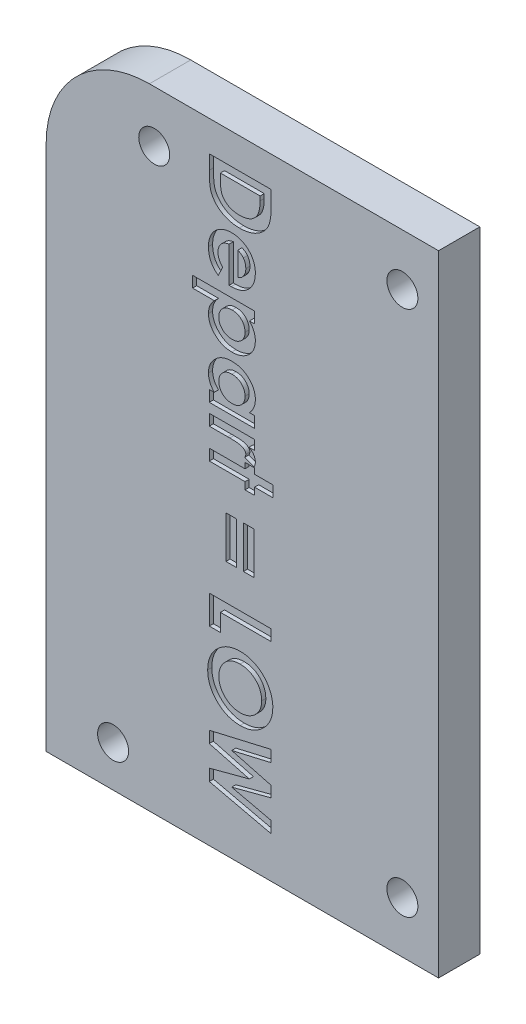
from build123d import *

# Parameters (mm, degrees)
ESQUISSE1_W             = 38
ESQUISSE1_H             = 61
BOSS_EXTRU_1_DEPTH      = 4
ESQUISSE2_R             = 1.5
ENL_V_MAT_EXTRU_1_DEPTH = 4
CONG_1_R                = 10
ESQUISSE3_W             = 1
ESQUISSE3_H             = 4.076923077
ENL_V_MAT_EXTRU_2_DEPTH = 0.4


with BuildPart() as part:
    # Esquisse1 → Boss.-Extru.1 (new body)
    with BuildSketch(Plane.XY):
        Rectangle(ESQUISSE1_W, ESQUISSE1_H)
    extrude(amount=BOSS_EXTRU_1_DEPTH)

    # Esquisse2 → Enlèv. mat.-Extru.1 (cut)
    with BuildSketch(Plane(origin=(0, 0, 0), x_dir=(-1, 0, 0), z_dir=(0, 0, -1))):
        with Locations((12.516935202, -26.5)):
            Circle(ESQUISSE2_R)
        with Locations((-15.5, -25.5)):
            Circle(ESQUISSE2_R)
        with Locations((-15.5, 25.5)):
            Circle(ESQUISSE2_R)
        with Locations((8.533870405, 25.5)):
            Circle(ESQUISSE2_R)
    extrude(amount=-ENL_V_MAT_EXTRU_1_DEPTH, mode=Mode.SUBTRACT)

    # Congé1
    cong_1_edges = [part.edges().sort_by_distance(p)[0] for p in [
        (-19, 30.5, 2),
    ]]
    fillet(cong_1_edges, radius=CONG_1_R)

    # Esquisse3 → Enlèv. mat.-Extru.2 (cut)
    # profile 1 of 11: a face of its own
    with BuildSketch(Plane.XY.offset(4)):
        with BuildLine():
            Line((2.796806549, 27.529674897), (2.796806549, 26.172703744))
            add(Edge.make_bspline(
                [(2.796806549, 26.172703744), (2.79606699, 26.066912251), (2.794637415, 25.862416099), (2.778530942, 25.566141362), (2.753757676, 25.290644531), (2.719686212, 25.035743694), (2.674571852, 24.801975856), (2.618077654, 24.589594657), (2.552445312, 24.397698949), (2.476172631, 24.224034615), (2.386674447, 24.065936146), (2.286138653, 23.916879099), (2.173043446, 23.775145164), (2.047129164, 23.639948218), (1.90923202, 23.510958965), (1.756575614, 23.39120527), (1.593113874, 23.276847929), (1.418279487, 23.169742397), (1.232417614, 23.074405098), (1.038453588, 22.989544212), (0.836261345, 22.918839767), (0.626120061, 22.861269698), (0.408638466, 22.815411956), (0.183402175, 22.783318105), (-0.049387045, 22.763479416), (-0.207159473, 22.761466797), (-0.287328066, 22.760444128)],
                knots=[0, 0, 0, 0, 1.443473934, 2.790251435, 4.047465151, 5.217279069, 6.298047006, 7.293970747, 8.213772908, 9.063072335, 9.878180301, 10.689410498, 11.514196541, 12.349783386, 13.208549609, 14.087984609, 14.994942826, 15.929749014, 16.883358292, 17.843153412, 18.816615524, 19.8034191, 20.814532747, 21.847477555, 22.906243002, 24, 24, 24, 24], degree=3))
            add(Edge.make_bspline(
                [(-0.287328066, 22.760444128), (-0.400451319, 22.763121755), (-0.623141064, 22.768392821), (-0.94993368, 22.812798134), (-1.263204743, 22.884604849), (-1.560467556, 22.985612486), (-1.839205035, 23.110693051), (-2.093833571, 23.26049247), (-2.324872243, 23.430707662), (-2.528487468, 23.622849104), (-2.704569502, 23.830562853), (-2.853612521, 24.04726499), (-2.973252606, 24.272760839), (-3.047946776, 24.471874663), (-3.094935085, 24.645012767), (-3.122086475, 24.796817126), (-3.147949477, 24.969468317), (-3.167158791, 25.164076646), (-3.184765321, 25.380389745), (-3.19421405, 25.618557276), (-3.20210564, 25.878179786), (-3.202821346, 26.058513325), (-3.203193451, 26.152271051)],
                knots=[0, 0, 0, 0, 1.315357893, 2.589359008, 3.828307697, 5.048525571, 6.235260212, 7.375784434, 8.478395391, 9.566323578, 10.624275077, 11.640246088, 12.619991216, 13.585951757, 14.107079058, 14.704817694, 15.378369799, 16.137463096, 16.978827496, 17.902494345, 18.909479843, 20, 20, 20, 20], degree=3))
            Line((-3.203193451, 26.152271051), (-3.203193451, 27.529674897))
            Line((-3.203193451, 27.529674897), (2.796806549, 27.529674897))
        make_face()
        with BuildLine():
            Line((1.719883472, 26.452751821), (-2.126270374, 26.452751821))
            Line((-2.126270374, 26.452751821), (-2.126270374, 25.890251821))
            add(Edge.make_bspline(
                [(-2.126270374, 25.890251821), (-2.126147733, 25.823322959), (-2.125911853, 25.694596478), (-2.114676675, 25.508744578), (-2.103399654, 25.336878695), (-2.081995493, 25.179471934), (-2.058152762, 25.03537874), (-2.024972339, 24.906578575), (-1.990119115, 24.790416307), (-1.945746641, 24.688310837), (-1.895802468, 24.594790545), (-1.837287079, 24.508201441), (-1.77230795, 24.424618697), (-1.698953934, 24.345605035), (-1.618196446, 24.270861118), (-1.529619109, 24.200830294), (-1.43349323, 24.13457345), (-1.329306409, 24.073808422), (-1.218175046, 24.018228603), (-1.101112872, 23.969125277), (-0.977481725, 23.927673078), (-0.847336326, 23.896194172), (-0.711484287, 23.869378292), (-0.569052119, 23.85001517), (-0.420505158, 23.839466074), (-0.319395256, 23.83807365), (-0.268097297, 23.837367205)],
                knots=[0, 0, 0, 0, 1.502785267, 2.890356349, 4.180881464, 5.369512404, 6.456827674, 7.458527365, 8.354953631, 9.177280646, 9.954299195, 10.732931168, 11.52132839, 12.330004022, 13.151395147, 13.990341431, 14.86389591, 15.771318928, 16.696852441, 17.652725226, 18.620174565, 19.621874256, 20.657747019, 21.729235313, 22.847930884, 24, 24, 24, 24], degree=3))
            add(Edge.make_bspline(
                [(-0.268097297, 23.837367205), (-0.189492434, 23.838802285), (-0.036219042, 23.84160058), (0.187027, 23.868586727), (0.397246592, 23.912515026), (0.593659552, 23.975196477), (0.776817906, 24.054208389), (0.945169913, 24.153110214), (1.101543655, 24.2676456), (1.193277509, 24.358217058), (1.239114241, 24.403472974)],
                knots=[0, 0, 0, 0, 1.13821349, 2.219428113, 3.251817212, 4.244760574, 5.201143372, 6.134805572, 7.068016741, 8, 8, 8, 8], degree=3))
            add(Edge.make_bspline(
                [(1.239114241, 24.403472974), (1.278173333, 24.448099593), (1.357947106, 24.539244408), (1.453536487, 24.699264752), (1.537521127, 24.875598883), (1.60411158, 25.072280798), (1.65677415, 25.287409654), (1.693094236, 25.522266761), (1.716433139, 25.77559441), (1.718708721, 25.951093903), (1.719883472, 26.041694128)],
                knots=[0, 0, 0, 0, 0.813307809, 1.661089106, 2.549956539, 3.493439533, 4.508053171, 5.589449661, 6.755572447, 8, 8, 8, 8], degree=3))
            Line((1.719883472, 26.041694128), (1.719883472, 26.452751821))
        make_face(mode=Mode.SUBTRACT)
    # profile 2 of 11: a face of its own
    with BuildSketch(Plane.XY.offset(4)):
        with BuildLine():
            Line((-1.280116528, 17.45635759), (-1.280116528, 20.914290282))
            add(Edge.make_bspline(
                [(-1.280116528, 20.914290282), (-1.320295744, 20.907239837), (-1.399251074, 20.893385155), (-1.513940541, 20.863299221), (-1.62202196, 20.824905057), (-1.723639807, 20.778892069), (-1.819331298, 20.726036037), (-1.908647601, 20.664383854), (-1.991509826, 20.594717522), (-2.067557845, 20.517439834), (-2.135698519, 20.433838868), (-2.195394057, 20.344320058), (-2.244340746, 20.248791027), (-2.285597726, 20.148346978), (-2.318277433, 20.042237363), (-2.340816006, 19.930306016), (-2.354129624, 19.812849651), (-2.356055286, 19.732834786), (-2.357039605, 19.691934513)],
                knots=[0, 0, 0, 0, 1.091296461, 2.144483647, 3.168565212, 4.157007626, 5.126487748, 6.090021542, 7.05641414, 8.019231907, 8.98705074, 9.938580405, 10.892824166, 11.854447369, 12.841318655, 13.858982407, 14.905600794, 16, 16, 16, 16], degree=3))
            add(Edge.make_bspline(
                [(-2.357039605, 19.691934513), (-2.355736205, 19.642565107), (-2.353169426, 19.545342207), (-2.330405914, 19.402909935), (-2.296022628, 19.26515718), (-2.244891797, 19.133387569), (-2.181242899, 19.006074758), (-2.101944205, 18.885314705), (-2.009313081, 18.769017151), (-1.937913046, 18.698061938), (-1.901510759, 18.661886436)],
                knots=[0, 0, 0, 0, 1.021034703, 2.010718019, 2.977989445, 3.954245119, 4.929443971, 5.918328161, 6.938689359, 8, 8, 8, 8], degree=3))
            Line((-1.901510759, 18.661886436), (-2.330597297, 17.760444128))
            add(Edge.make_bspline(
                [(-2.330597297, 17.760444128), (-2.369784213, 17.78927328), (-2.447241979, 17.846257649), (-2.556510512, 17.938061554), (-2.659260619, 18.032697673), (-2.753322711, 18.132660306), (-2.83841034, 18.23769998), (-2.916969318, 18.34559936), (-2.986896196, 18.458248997), (-3.049756849, 18.574777248), (-3.104055068, 18.697050893), (-3.150285907, 18.824665236), (-3.192099133, 18.957016263), (-3.223953422, 19.095792829), (-3.249170478, 19.239834497), (-3.267077551, 19.389487197), (-3.278137987, 19.544730827), (-3.279449181, 19.650249033), (-3.280116528, 19.703953744)],
                knots=[0, 0, 0, 0, 1.033338888, 2.04252164, 3.030262006, 3.999752838, 4.955583682, 5.900551376, 6.833481756, 7.770287093, 8.71145193, 9.672837889, 10.652846169, 11.658324827, 12.695268294, 13.758430956, 14.85912751, 16, 16, 16, 16], degree=3))
            add(Edge.make_bspline(
                [(-3.280116528, 19.703953744), (-3.278432077, 19.786577557), (-3.275133176, 19.948391535), (-3.244514663, 20.185073734), (-3.193745858, 20.409856154), (-3.124733501, 20.623373607), (-3.033615435, 20.824702754), (-2.922170973, 21.01394461), (-2.792534502, 21.192984804), (-2.641993752, 21.356372023), (-2.478113844, 21.505166419), (-2.302210306, 21.636062575), (-2.114943689, 21.744936092), (-1.919360222, 21.837013769), (-1.711820951, 21.904515448), (-1.495275904, 21.955466402), (-1.268173581, 21.986149412), (-1.113543476, 21.9895065), (-1.03492422, 21.991213359)],
                knots=[0, 0, 0, 0, 1.103528868, 2.161197684, 3.181904866, 4.17893931, 5.15400521, 6.128071465, 7.108807125, 8.101535823, 9.090664498, 10.062772592, 11.024896103, 11.980490186, 12.945349712, 13.934753549, 14.949957771, 16, 16, 16, 16], degree=3))
            add(Edge.make_bspline(
                [(-1.03492422, 21.991213359), (-0.95430224, 21.98950273), (-0.795682115, 21.986137143), (-0.563405704, 21.955586402), (-0.341759951, 21.904873066), (-0.130545556, 21.834733061), (0.071471221, 21.746588775), (0.260877789, 21.634139607), (0.440643048, 21.504157141), (0.608301714, 21.355738059), (0.759693481, 21.191695359), (0.894661244, 21.017375923), (1.006695503, 20.831030503), (1.09818034, 20.635051496), (1.171631947, 20.429743378), (1.220804381, 20.212992549), (1.253761264, 19.986617689), (1.256800365, 19.831879435), (1.25834501, 19.75323259)],
                knots=[0, 0, 0, 0, 1.079354094, 2.123580709, 3.131027717, 4.120248802, 5.100347326, 6.076737579, 7.064152558, 8.067633759, 9.069995403, 10.049814825, 11.015114092, 11.975254693, 12.94256508, 13.929104949, 14.947452504, 16, 16, 16, 16], degree=3))
            add(Edge.make_bspline(
                [(1.25834501, 19.75323259), (1.25663569, 19.670212383), (1.253279614, 19.507210762), (1.222891871, 19.268888182), (1.171877699, 19.04258431), (1.103119814, 18.827156668), (1.010326199, 18.625126522), (0.90124942, 18.432966413), (0.768860244, 18.255041344), (0.619054387, 18.089229984), (0.452783521, 17.939687951), (0.272635509, 17.808561673), (0.078774962, 17.698923767), (-0.12730348, 17.608366516), (-0.34661749, 17.53872992), (-0.578307819, 17.48831166), (-0.823364496, 17.457697583), (-0.991164566, 17.454425458), (-1.076991528, 17.452751821)],
                knots=[0, 0, 0, 0, 1.079855552, 2.120185087, 3.119263157, 4.095157605, 5.056350796, 6.006812003, 6.964961307, 7.935564877, 8.91003822, 9.869321262, 10.82883089, 11.80218819, 12.792963453, 13.817487929, 14.883681165, 16, 16, 16, 16], degree=3))
            Line((-1.076991528, 17.452751821), (-1.280116528, 17.45635759))
        make_face()
        with BuildLine():
            add(Edge.make_bspline(
                [(-0.433962682, 18.529674897), (-0.379044422, 18.549881531), (-0.269655534, 18.590130096), (-0.120426303, 18.683147368), (0.011124009, 18.802650145), (0.125925444, 18.94376643), (0.219655164, 19.10459348), (0.287414368, 19.28059155), (0.328068325, 19.469333005), (0.332834355, 19.599184595), (0.335268087, 19.665492205)],
                knots=[0, 0, 0, 0, 0.954352776, 1.900926752, 2.851296618, 3.847186113, 4.86225778, 5.87988081, 6.91737917, 8, 8, 8, 8], degree=3))
            add(Edge.make_bspline(
                [(0.335268087, 19.665492205), (0.332929669, 19.737910197), (0.328358547, 19.879472291), (0.279742994, 20.083665974), (0.207185732, 20.276276766), (0.132377654, 20.389829172), (0.094883472, 20.446742205)],
                knots=[0, 0, 0, 0, 1.044195649, 2.041185066, 3.018232172, 4, 4, 4, 4], degree=3))
            add(Edge.make_bspline(
                [(0.094883472, 20.446742205), (0.066327082, 20.482251687), (0.005446317, 20.557956088), (-0.116005028, 20.656273611), (-0.263055343, 20.753117189), (-0.374750446, 20.808178103), (-0.433962682, 20.837367205)],
                knots=[0, 0, 0, 0, 0.82159062, 1.751589201, 2.808063854, 4, 4, 4, 4], degree=3))
            Line((-0.433962682, 20.837367205), (-0.433962682, 18.529674897))
        make_face(mode=Mode.SUBTRACT)
    # profile 3 of 11: a face of its own
    with BuildSketch(Plane.XY.offset(4)):
        with BuildLine():
            Line((1.181421934, 15.452751821), (0.687431549, 15.452751821))
            add(Edge.make_bspline(
                [(0.687431549, 15.452751821), (0.733368744, 15.402755353), (0.823584653, 15.304567451), (0.939070638, 15.143801369), (1.038321962, 14.978612701), (1.117752888, 14.806204574), (1.181400431, 14.628655243), (1.224749864, 14.44433548), (1.254418525, 14.254191295), (1.257024106, 14.125143813), (1.25834501, 14.059722974)],
                knots=[0, 0, 0, 0, 1.054345398, 2.070625563, 3.070134531, 4.045138923, 5.016019057, 5.996139535, 6.984139557, 8, 8, 8, 8], degree=3))
            add(Edge.make_bspline(
                [(1.25834501, 14.059722974), (1.256653401, 13.989099533), (1.25332148, 13.84999427), (1.222213202, 13.645327348), (1.17192882, 13.449191039), (1.101718089, 13.260837513), (1.010561289, 13.081269972), (0.901417825, 12.90847208), (0.769785758, 12.745419212), (0.620684314, 12.592050524), (0.457280897, 12.450125898), (0.279542005, 12.326878543), (0.090337291, 12.223551637), (-0.109797141, 12.138708029), (-0.321200333, 12.072751439), (-0.543905771, 12.024380592), (-0.778222776, 11.996887811), (-0.93789879, 11.993129361), (-1.01929922, 11.991213359)],
                knots=[0, 0, 0, 0, 0.986020426, 1.942140297, 2.884184618, 3.810402461, 4.74398011, 5.692601402, 6.660167734, 7.665472218, 8.677406811, 9.678762208, 10.680617953, 11.68372348, 12.710362081, 13.769660087, 14.863006259, 16, 16, 16, 16], degree=3))
            add(Edge.make_bspline(
                [(-1.01929922, 11.991213359), (-1.097909875, 11.993036678), (-1.252868809, 11.996630842), (-1.480344561, 12.02573917), (-1.69771221, 12.074899393), (-1.90459815, 12.144412694), (-2.102917909, 12.230602603), (-2.291296898, 12.337948825), (-2.468077341, 12.46674105), (-2.634585408, 12.610782976), (-2.784366131, 12.769951047), (-2.917454529, 12.936479497), (-3.029125386, 13.111484343), (-3.120946153, 13.293337261), (-3.192487561, 13.483126509), (-3.242209799, 13.679937408), (-3.27553319, 13.883511719), (-3.278573532, 14.021927754), (-3.280116528, 14.092174897)],
                knots=[0, 0, 0, 0, 1.098417511, 2.1652231, 3.198950626, 4.208261081, 5.211182938, 6.216867778, 7.231677337, 8.263598561, 9.289470716, 10.282037912, 11.238882362, 12.185464344, 13.124613954, 14.067146156, 15.019062619, 16, 16, 16, 16], degree=3))
            add(Edge.make_bspline(
                [(-3.280116528, 14.092174897), (-3.278598413, 14.154772452), (-3.275607819, 14.278085868), (-3.24894287, 14.459415375), (-3.209114501, 14.634581739), (-3.149168365, 14.803816668), (-3.069620347, 14.969022666), (-2.970557673, 15.133013396), (-2.849535754, 15.296168067), (-2.756191566, 15.399437389), (-2.708001143, 15.452751821)],
                knots=[0, 0, 0, 0, 0.990856396, 1.951927477, 2.896945079, 3.83213376, 4.788585491, 5.796263726, 6.862286081, 8, 8, 8, 8], degree=3))
            Line((-2.708001143, 15.452751821), (-4.818578066, 15.452751821))
            Line((-4.818578066, 15.452751821), (-4.818578066, 16.529674897))
            Line((-4.818578066, 16.529674897), (1.181421934, 16.529674897))
            Line((1.181421934, 16.529674897), (1.181421934, 15.452751821))
        make_face()
        with BuildLine():
            add(Edge.make_bspline(
                [(0.25834501, 14.292896051), (0.257001098, 14.33660084), (0.2543663, 14.422285986), (0.239265295, 14.548086743), (0.210855666, 14.667287614), (0.174024097, 14.781689527), (0.124343677, 14.889885587), (0.063988831, 14.992605139), (-0.007306265, 15.08931372), (-0.089293814, 15.178770476), (-0.178123929, 15.262094095), (-0.276785629, 15.332624703), (-0.379866377, 15.394772362), (-0.490907926, 15.444484377), (-0.608686945, 15.482473303), (-0.732931992, 15.510500089), (-0.86387204, 15.525764399), (-0.95315667, 15.528350782), (-0.998866528, 15.529674897)],
                knots=[0, 0, 0, 0, 1.060568847, 2.079291485, 3.067175794, 4.029236509, 4.990511307, 5.949030319, 6.915206611, 7.899210179, 8.889768581, 9.863784456, 10.835615511, 11.805743859, 12.80777611, 13.833568643, 14.890881125, 16, 16, 16, 16], degree=3))
            add(Edge.make_bspline(
                [(-0.998866528, 15.529674897), (-1.045376334, 15.528334123), (-1.136653832, 15.525702795), (-1.270386119, 15.510565356), (-1.397119737, 15.482736216), (-1.516991319, 15.443948712), (-1.630744814, 15.395106577), (-1.736390067, 15.333002327), (-1.836424917, 15.261703084), (-1.927649974, 15.179241401), (-2.010715482, 15.089247913), (-2.083415049, 14.992966858), (-2.143858524, 14.889910616), (-2.192725925, 14.781197502), (-2.233363516, 14.667808555), (-2.2608155, 14.548011866), (-2.276196542, 14.422305854), (-2.278792452, 14.336607551), (-2.280116528, 14.292896051)],
                knots=[0, 0, 0, 0, 1.117303121, 2.19275548, 3.227126012, 4.228333087, 5.215193878, 6.193951608, 7.166063962, 8.161008357, 9.141703709, 10.104002538, 11.052977519, 12.004680845, 12.963364262, 13.941412147, 14.949991302, 16, 16, 16, 16], degree=3))
            add(Edge.make_bspline(
                [(-2.280116528, 14.292896051), (-2.278901855, 14.250770044), (-2.276497498, 14.167384713), (-2.259231833, 14.045069765), (-2.232223892, 13.927562787), (-2.191443976, 13.816014909), (-2.141402108, 13.709027659), (-2.079484914, 13.606961162), (-2.005483192, 13.510922765), (-1.922139301, 13.419600661), (-1.828805021, 13.337949194), (-1.730000891, 13.264361662), (-1.623388875, 13.204452811), (-1.510854005, 13.15523524), (-1.392915642, 13.114933666), (-1.267982407, 13.087310214), (-1.137064299, 13.072138131), (-1.047782019, 13.069483586), (-1.002472297, 13.068136436)],
                knots=[0, 0, 0, 0, 1.021479428, 2.021943319, 2.990662685, 3.940432525, 4.896741647, 5.851667391, 6.829265152, 7.833309205, 8.845269013, 9.832622089, 10.816142259, 11.803782204, 12.808625337, 13.834164129, 14.900863427, 16, 16, 16, 16], degree=3))
            add(Edge.make_bspline(
                [(-1.002472297, 13.068136436), (-0.957569867, 13.069504484), (-0.869099507, 13.072199921), (-0.739276504, 13.087069784), (-0.616141971, 13.115724342), (-0.498689986, 13.151904371), (-0.388449471, 13.202451113), (-0.284116297, 13.262217539), (-0.185375437, 13.332543812), (-0.094892412, 13.41412532), (-0.01255936, 13.503605854), (0.060264904, 13.599124801), (0.122259102, 13.700307048), (0.171148549, 13.808530476), (0.211374028, 13.921241183), (0.239081869, 14.040161624), (0.254416939, 14.164687218), (0.257018067, 14.249585788), (0.25834501, 14.292896051)],
                knots=[0, 0, 0, 0, 1.094680664, 2.156827393, 3.177782763, 4.17210342, 5.146667393, 6.126451192, 7.099203661, 8.094961544, 9.09004898, 10.058676268, 11.018205477, 11.974998356, 12.947750825, 13.930643515, 14.944335875, 16, 16, 16, 16], degree=3))
        make_face(mode=Mode.SUBTRACT)
    # profile 4 of 11: a face of its own
    with BuildSketch(Plane.XY.offset(4)):
        with BuildLine():
            Line((1.181421934, 7.760444128), (1.181421934, 6.683521051))
            Line((1.181421934, 6.683521051), (-3.203193451, 6.683521051))
            Line((-3.203193451, 6.683521051), (-3.203193451, 7.760444128))
            Line((-3.203193451, 7.760444128), (-2.724828066, 7.760444128))
            add(Edge.make_bspline(
                [(-2.724828066, 7.760444128), (-2.77138617, 7.81380768), (-2.861746255, 7.917375796), (-2.979079325, 8.080525328), (-3.075355333, 8.243986807), (-3.153353852, 8.408498004), (-3.209379433, 8.577554885), (-3.250897086, 8.751567386), (-3.275117471, 8.932839896), (-3.278432818, 9.056046387), (-3.280116528, 9.118617205)],
                knots=[0, 0, 0, 0, 1.129160586, 2.191477711, 3.199794721, 4.151823543, 5.089502826, 6.035032201, 7.00208469, 8, 8, 8, 8], degree=3))
            add(Edge.make_bspline(
                [(-3.280116528, 9.118617205), (-3.278536242, 9.188857579), (-3.275413509, 9.32765654), (-3.242545049, 9.531329928), (-3.192225353, 9.727991684), (-3.121042923, 9.917506713), (-3.028707807, 10.099437831), (-2.918233703, 10.275264114), (-2.783934312, 10.440925969), (-2.634260141, 10.600011502), (-2.468468184, 10.745294075), (-2.291291655, 10.874087107), (-2.10262512, 10.981114545), (-1.904909982, 11.069092679), (-1.697668704, 11.138197163), (-1.480356687, 11.187484481), (-1.252865632, 11.216557848), (-1.097908806, 11.220156828), (-1.01929922, 11.22198259)],
                knots=[0, 0, 0, 0, 0.980545136, 1.937612761, 2.874348888, 3.813122963, 4.759326438, 5.720509799, 6.70829705, 7.733758992, 8.768951258, 9.783355028, 10.788637727, 11.793421666, 12.80232853, 13.835642703, 14.90202171, 16, 16, 16, 16], degree=3))
            add(Edge.make_bspline(
                [(-1.01929922, 11.22198259), (-0.937898439, 11.220067226), (-0.778221735, 11.216310025), (-0.543909698, 11.188808236), (-0.321186283, 11.140469982), (-0.109847364, 11.074396867), (0.090698555, 10.989900458), (0.279194146, 10.88488371), (0.457331759, 10.761960714), (0.620671573, 10.619919032), (0.769785863, 10.466579989), (0.901428976, 10.303524484), (1.010517753, 10.130709312), (1.102048675, 9.950876723), (1.171437176, 9.762245939), (1.222581775, 9.565951246), (1.253193861, 9.361171761), (1.256613701, 9.221684961), (1.25834501, 9.151069128)],
                knots=[0, 0, 0, 0, 1.136421085, 2.229216585, 3.287981067, 4.314102594, 5.316702899, 6.320753391, 7.321604446, 8.333029371, 9.337827526, 10.304906535, 11.253050047, 12.186157492, 13.117149921, 14.053303955, 15.014476191, 16, 16, 16, 16], degree=3))
            add(Edge.make_bspline(
                [(1.25834501, 9.151069128), (1.256986021, 9.08565515), (1.254297072, 8.956224465), (1.225100226, 8.765980007), (1.180942069, 8.581470321), (1.118024644, 8.403701918), (1.038578595, 8.231216681), (0.939026774, 8.066981466), (0.8235533, 7.907403479), (0.73336607, 7.810035816), (0.687431549, 7.760444128)],
                knots=[0, 0, 0, 0, 1.017011718, 2.012299608, 2.98747302, 3.965332399, 4.941441765, 5.936729654, 6.94912688, 8, 8, 8, 8], degree=3))
            Line((0.687431549, 7.760444128), (1.181421934, 7.760444128))
        make_face()
        with BuildLine():
            add(Edge.make_bspline(
                [(0.25834501, 8.92510759), (0.257028316, 8.9680198), (0.25444768, 9.05212493), (0.238924976, 9.175813033), (0.211573281, 9.294021755), (0.171167024, 9.40590804), (0.121946316, 9.513139405), (0.060298189, 9.614087525), (-0.012568587, 9.709585555), (-0.094889908, 9.799071861), (-0.185376091, 9.880651815), (-0.284116122, 9.950978496), (-0.388449518, 10.010744813), (-0.498689974, 10.061291585), (-0.616141974, 10.097471605), (-0.739276503, 10.126126166), (-0.869099508, 10.140996028), (-0.957569867, 10.143691465), (-1.002472297, 10.145059513)],
                knots=[0, 0, 0, 0, 1.04836806, 2.054732945, 3.03993516, 4.00574415, 4.955904794, 5.917688631, 6.888591924, 7.88601754, 8.884115178, 9.859153345, 10.841239365, 11.818093293, 12.814750328, 13.83810466, 14.90274714, 16, 16, 16, 16], degree=3))
            add(Edge.make_bspline(
                [(-1.002472297, 10.145059513), (-1.047782366, 10.143712969), (-1.13706533, 10.141059619), (-1.267978489, 10.125878887), (-1.392929597, 10.098286671), (-1.510803376, 10.057872226), (-1.623757324, 10.008987441), (-1.729651928, 9.947417875), (-1.828838351, 9.874123366), (-1.922201853, 9.792423599), (-2.004992023, 9.701111686), (-2.080318447, 9.605992015), (-2.140607302, 9.503332881), (-2.19212895, 9.396678463), (-2.231700139, 9.285057811), (-2.259462347, 9.167791447), (-2.276451648, 9.04579772), (-2.278886466, 8.962421369), (-2.280116528, 8.920299897)],
                knots=[0, 0, 0, 0, 1.099386164, 2.166327687, 3.192099357, 4.19717067, 5.185034887, 6.173616074, 7.161193358, 8.17338296, 9.177655011, 10.147763629, 11.111227589, 12.058972978, 13.018112925, 13.97759754, 14.978288615, 16, 16, 16, 16], degree=3))
            add(Edge.make_bspline(
                [(-2.280116528, 8.920299897), (-2.278792413, 8.876588435), (-2.276196429, 8.790890207), (-2.260815927, 8.66518366), (-2.233361978, 8.545388914), (-2.192731532, 8.431992908), (-2.143837775, 8.323305826), (-2.08349272, 8.220152377), (-2.010239171, 8.124005621), (-1.928561595, 8.032595217), (-1.835496722, 7.951857258), (-1.737224044, 7.87853355), (-1.630298123, 7.818435366), (-1.517063255, 7.769131055), (-1.397099662, 7.730492154), (-1.27039178, 7.70262145), (-1.136652328, 7.687495582), (-1.045375827, 7.684862646), (-0.998866528, 7.683521051)],
                knots=[0, 0, 0, 0, 1.049905731, 2.058385982, 3.036337956, 3.994927362, 4.946537361, 5.895419282, 6.857623746, 7.845325573, 8.833777008, 9.811444928, 10.78531754, 11.772081556, 12.77319045, 13.807459548, 14.882806445, 16, 16, 16, 16], degree=3))
            add(Edge.make_bspline(
                [(-0.998866528, 7.683521051), (-0.953157181, 7.684845974), (-0.863873547, 7.687433934), (-0.732926361, 7.702686952), (-0.608707189, 7.730754677), (-0.490835201, 7.768596503), (-0.380313683, 7.818754509), (-0.275944792, 7.878923269), (-0.17905943, 7.951451361), (-0.088367504, 8.033075934), (-0.007834529, 8.123962544), (0.06446332, 8.220683906), (0.123951603, 8.324343814), (0.174337743, 8.432985164), (0.210809698, 8.548351942), (0.239149971, 8.668336191), (0.254436823, 8.794911266), (0.257021022, 8.881000596), (0.25834501, 8.92510759)],
                knots=[0, 0, 0, 0, 1.106469885, 2.16125711, 3.184599668, 4.184238692, 5.152050012, 6.116650044, 7.094080022, 8.075733422, 9.064591803, 10.028460505, 10.993060537, 11.952039452, 12.921015874, 13.915988178, 14.932277727, 16, 16, 16, 16], degree=3))
        make_face(mode=Mode.SUBTRACT)
    # profile 5 of 11: a face of its own
    with BuildSketch(Plane.XY.offset(4)):
        with BuildLine():
            Line((1.181421934, 5.760444128), (1.181421934, 4.837367205))
            Line((1.181421934, 4.837367205), (0.641758472, 4.837367205))
            add(Edge.make_bspline(
                [(0.641758472, 4.837367205), (0.68972345, 4.811258866), (0.78347299, 4.760229034), (0.909231465, 4.666417531), (1.015672353, 4.558658894), (1.103243682, 4.439879), (1.172170287, 4.311829408), (1.221702392, 4.177131668), (1.253323228, 4.036343461), (1.25665903, 3.940098079), (1.25834501, 3.891453744)],
                knots=[0, 0, 0, 0, 1.098811016, 2.147671717, 3.146071787, 4.13848817, 5.109520547, 6.064226209, 7.021621331, 8, 8, 8, 8], degree=3))
            add(Edge.make_bspline(
                [(1.25834501, 3.891453744), (1.256690887, 3.856129021), (1.253322501, 3.784195272), (1.233742022, 3.674558116), (1.198336793, 3.563339088), (1.166459089, 3.490147384), (1.150171934, 3.452751821)],
                knots=[0, 0, 0, 0, 0.931404136, 1.896671404, 2.925354185, 4, 4, 4, 4], degree=3))
            Line((1.150171934, 3.452751821), (0.237912318, 3.786886436))
            add(Edge.make_bspline(
                [(0.237912318, 3.786886436), (0.252342542, 3.816753299), (0.279465809, 3.872891505), (0.311474058, 3.954394431), (0.331003927, 4.028361717), (0.333917955, 4.075255618), (0.335268087, 4.09698259)],
                knots=[0, 0, 0, 0, 1.214386998, 2.282580073, 3.20428172, 4, 4, 4, 4], degree=3))
            add(Edge.make_bspline(
                [(0.335268087, 4.09698259), (0.334373418, 4.117497076), (0.332613449, 4.157852606), (0.317531115, 4.21741624), (0.291522096, 4.273512774), (0.258201965, 4.328845527), (0.211884475, 4.37904924), (0.158263819, 4.429222339), (0.092061721, 4.473435933), (0.018376527, 4.52010125), (-0.071819075, 4.559804498), (-0.179471017, 4.593991182), (-0.306012508, 4.623803604), (-0.4514405, 4.647191347), (-0.615572241, 4.664677596), (-0.798382695, 4.677538101), (-0.999985067, 4.686236283), (-1.140683513, 4.686821714), (-1.214010759, 4.687126821)],
                knots=[0, 0, 0, 0, 0.544215582, 1.070565812, 1.618201885, 2.182027731, 2.777483228, 3.425105563, 4.127550611, 4.886526539, 5.73878038, 6.7345772, 7.882815618, 9.187506016, 10.643077814, 12.264316551, 14.053088836, 16, 16, 16, 16], degree=3))
            Line((-1.214010759, 4.687126821), (-1.427953066, 4.683521051))
            Line((-1.427953066, 4.683521051), (-3.203193451, 4.683521051))
            Line((-3.203193451, 4.683521051), (-3.203193451, 5.760444128))
            Line((-3.203193451, 5.760444128), (1.181421934, 5.760444128))
        make_face()
    # profile 6 of 11: a face of its own
    with BuildSketch(Plane.XY.offset(4)):
        Polygon((2.950652703, 2.837367205), (2.950652703, 1.760444128), (1.181421934, 1.760444128), (1.181421934, 1.068136436), (0.25834501, 1.068136436), (0.25834501, 1.760444128), (-3.203193451, 1.760444128), (-3.203193451, 2.837367205), (0.25834501, 2.837367205), (0.25834501, 3.375828744), (1.181421934, 3.375828744), (1.181421934, 2.837367205), align=None)
    # profile 7 of 11: a face of its own
    with BuildSketch(Plane.XY.offset(4)):
        with Locations((0.604498857, -3.816478949)):
            Rectangle(ESQUISSE3_W, ESQUISSE3_H)
    # profile 8 of 11: a face of its own
    with BuildSketch(Plane.XY.offset(4)):
        with Locations((-1.087808836, -3.816478949)):
            Rectangle(ESQUISSE3_W, ESQUISSE3_H)
    # profile 9 of 11: a face of its own
    with BuildSketch(Plane.XY.offset(4)):
        Polygon((2.796806549, -9.316478949), (2.796806549, -10.393402026), (-2.126270374, -10.393402026), (-2.126270374, -12.085709718), (-3.203193451, -12.085709718), (-3.203193451, -9.316478949), align=None)
    # profile 10 of 11: a face of its own
    with BuildSketch(Plane.XY.offset(4)):
        with BuildLine():
            add(Edge.make_bspline(
                [(2.950652703, -15.828498179), (2.947953351, -15.932816378), (2.942624218, -16.13876413), (2.898152005, -16.441624312), (2.825814697, -16.733542948), (2.724700181, -17.014458179), (2.594180606, -17.283988452), (2.433718598, -17.541442807), (2.24581213, -17.78848331), (2.030806355, -18.020549216), (1.795857339, -18.233416097), (1.545358947, -18.42057538), (1.282106101, -18.579017365), (1.006332224, -18.708587341), (0.717462994, -18.808919116), (0.415649244, -18.87895321), (0.101448046, -18.924052223), (-0.112491751, -18.929231369), (-0.221222297, -18.931863564)],
                knots=[0, 0, 0, 0, 1.014244935, 2.002349224, 2.970143685, 3.935298574, 4.900830986, 5.877310296, 6.881148894, 7.915268703, 8.949887647, 9.960720774, 10.951801935, 11.933244874, 12.919141415, 13.920101769, 14.942934067, 16, 16, 16, 16], degree=3))
            add(Edge.make_bspline(
                [(-0.221222297, -18.931863564), (-0.328727822, -18.929060407), (-0.540570907, -18.923536697), (-0.851874886, -18.880791172), (-1.150461928, -18.809584283), (-1.436503151, -18.710915376), (-1.710060644, -18.583839917), (-1.970848718, -18.428194724), (-2.21787324, -18.24255937), (-2.450528077, -18.033050265), (-2.66164738, -17.802394084), (-2.848202776, -17.558000728), (-3.0051505, -17.300356209), (-3.134775291, -17.031281425), (-3.234988514, -16.749599886), (-3.305763571, -16.455951032), (-3.348758549, -16.150285116), (-3.354251492, -15.942419999), (-3.357039605, -15.836911641)],
                knots=[0, 0, 0, 0, 1.051446269, 2.071908608, 3.067230498, 4.050151293, 5.026863609, 6.012936299, 7.01551645, 8.045060801, 9.071444569, 10.070117656, 11.048150216, 12.017576978, 12.987003741, 13.967083865, 14.968130643, 16, 16, 16, 16], degree=3))
            add(Edge.make_bspline(
                [(-3.357039605, -15.836911641), (-3.354538848, -15.726562323), (-3.349625203, -15.509740998), (-3.302898678, -15.192422017), (-3.232512209, -14.888403015), (-3.127464181, -14.600237926), (-2.996145312, -14.324992035), (-2.834418251, -14.064687654), (-2.642550266, -13.819412263), (-2.425455167, -13.590572802), (-2.187905512, -13.383243697), (-1.936955367, -13.200235093), (-1.674521771, -13.045863276), (-1.400481898, -12.920122598), (-1.116538841, -12.820993698), (-0.820963304, -12.751069522), (-0.514464185, -12.709763643), (-0.306283856, -12.704009974), (-0.200789605, -12.701094333)],
                knots=[0, 0, 0, 0, 1.067978421, 2.098431617, 3.099715153, 4.085208694, 5.062210972, 6.048429807, 7.046490867, 8.072918869, 9.098532598, 10.095778865, 11.076610158, 12.041847152, 13.011192615, 13.984257998, 14.978533688, 16, 16, 16, 16], degree=3))
            add(Edge.make_bspline(
                [(-0.200789605, -12.701094333), (-0.129821571, -12.702021789), (0.011215879, -12.703864957), (0.220278637, -12.725590466), (0.424968142, -12.757791776), (0.625636203, -12.801947825), (0.821529198, -12.861061147), (1.013063272, -12.933858368), (1.200982346, -13.017601783), (1.383472813, -13.115192347), (1.558774247, -13.223770313), (1.726083646, -13.342219864), (1.883364329, -13.470864993), (2.031680696, -13.609265262), (2.169948474, -13.757975982), (2.300745178, -13.915003767), (2.418797723, -14.084273395), (2.529603208, -14.260279967), (2.628893119, -14.442717962), (2.714452279, -14.630541801), (2.788239562, -14.820870767), (2.846813816, -15.015990951), (2.894458273, -15.21363507), (2.925981051, -15.415870773), (2.94788632, -15.620882695), (2.949728387, -15.75912878), (2.950652703, -15.828498179)],
                knots=[0, 0, 0, 0, 1.034751683, 2.056401036, 3.062285641, 4.056148242, 5.050783641, 6.043890034, 7.043081327, 8.049576835, 9.059882113, 10.048974407, 11.037410495, 12.021414423, 13.005418351, 13.997561464, 14.999568372, 16.012961702, 17.030138968, 18.026421002, 19.021605583, 20.005054086, 20.995836695, 21.984410968, 22.988613675, 24, 24, 24, 24], degree=3))
        make_face()
        with BuildLine():
            add(Edge.make_bspline(
                [(1.873729626, -15.811671256), (1.871845851, -15.741465695), (1.868128032, -15.60290801), (1.839803352, -15.399669061), (1.794565441, -15.204552717), (1.729039509, -15.018639535), (1.645639381, -14.841127626), (1.54466656, -14.671687825), (1.422611617, -14.512721464), (1.286173247, -14.361896955), (1.133521553, -14.226111304), (0.971711615, -14.10402161), (0.796850013, -14.005307138), (0.614696216, -13.920426784), (0.420643747, -13.857729515), (0.217842061, -13.809992082), (0.004209256, -13.783991122), (-0.141030012, -13.780037016), (-0.215212682, -13.77801741)],
                knots=[0, 0, 0, 0, 1.033668485, 2.040047952, 3.016132939, 3.979056467, 4.937231767, 5.900589077, 6.877725736, 7.88429546, 8.891280164, 9.882584218, 10.863295226, 11.842887319, 12.837417301, 13.860812229, 14.907384602, 16, 16, 16, 16], degree=3))
            add(Edge.make_bspline(
                [(-0.215212682, -13.77801741), (-0.29744901, -13.780466784), (-0.458618587, -13.78526715), (-0.693814716, -13.818705375), (-0.91546662, -13.876782654), (-1.124339164, -13.957587735), (-1.31936512, -14.062691384), (-1.501596304, -14.190113993), (-1.670143921, -14.340986131), (-1.768604863, -14.457077015), (-1.818578066, -14.515998179)],
                knots=[0, 0, 0, 0, 1.078379799, 2.113445728, 3.107478808, 4.077334175, 5.043482131, 6.005506737, 6.987708079, 8, 8, 8, 8], degree=3))
            add(Edge.make_bspline(
                [(-1.818578066, -14.515998179), (-1.855492363, -14.564274657), (-1.92848927, -14.659739935), (-2.022049781, -14.812123302), (-2.102240472, -14.969048165), (-2.167033602, -15.131698718), (-2.217998789, -15.299731452), (-2.253688872, -15.473123324), (-2.276087485, -15.651628653), (-2.278764544, -15.772342321), (-2.280116528, -15.833305872)],
                knots=[0, 0, 0, 0, 1.023928204, 2.024787132, 3.009472467, 3.9914905, 4.972207045, 5.96565515, 6.972602802, 8, 8, 8, 8], degree=3))
            add(Edge.make_bspline(
                [(-2.280116528, -15.833305872), (-2.278216881, -15.902304324), (-2.274479264, -16.03806095), (-2.246501847, -16.237515392), (-2.199161455, -16.428603703), (-2.134190927, -16.612488974), (-2.049816487, -16.78872734), (-1.945266692, -16.95640247), (-1.823574537, -17.116740937), (-1.684783706, -17.267301668), (-1.532059618, -17.404802209), (-1.368562843, -17.525116716), (-1.196363618, -17.627317275), (-1.015338416, -17.710173612), (-0.82554714, -17.776025469), (-0.626721811, -17.820707399), (-0.419577368, -17.849502829), (-0.278612195, -17.853105269), (-0.20679922, -17.854940487)],
                knots=[0, 0, 0, 0, 1.026250569, 2.01918027, 2.989144455, 3.950556051, 4.91558185, 5.889785058, 6.885144561, 7.905911388, 8.931486752, 9.937601838, 10.920932928, 11.905004308, 12.894547393, 13.903711934, 14.932071819, 16, 16, 16, 16], degree=3))
            add(Edge.make_bspline(
                [(-0.20679922, -17.854940487), (-0.135398854, -17.853042359), (0.005141879, -17.849306185), (0.211748954, -17.821280924), (0.409714151, -17.774235648), (0.599360767, -17.709089044), (0.780874727, -17.625900279), (0.953617721, -17.523028932), (1.117422747, -17.400835966), (1.271173538, -17.262133645), (1.412460666, -17.111164692), (1.535072209, -16.949084437), (1.641617743, -16.780428067), (1.725081211, -16.601325781), (1.791576379, -16.415441864), (1.840544375, -16.22164204), (1.867929056, -16.019192281), (1.871778868, -15.881461525), (1.873729626, -15.811671256)],
                knots=[0, 0, 0, 0, 1.055025985, 2.07665775, 3.074803781, 4.057872707, 5.035505728, 6.020516407, 7.023567878, 8.050795229, 9.077271434, 10.074415901, 11.050397877, 12.019801805, 12.988065821, 13.964604439, 14.968634123, 16, 16, 16, 16], degree=3))
        make_face(mode=Mode.SUBTRACT)
    # profile 11 of 11: a face of its own
    with BuildSketch(Plane.XY.offset(4)):
        Polygon((2.796806549, -19.431863564), (2.796806549, -20.54364241), (-1.033722297, -21.431863564), (2.796806549, -22.44989241), (2.796806549, -23.49676741), (-1.033722297, -24.508786641), (2.796806549, -25.394603949), (2.796806549, -26.508786641), (-3.203193451, -25.120565487), (-3.203193451, -23.995565487), (0.675412318, -22.970325103), (-3.203193451, -21.939075103), (-3.203193451, -20.822488564), align=None)
    extrude(amount=-ENL_V_MAT_EXTRU_2_DEPTH, mode=Mode.SUBTRACT)


solid = part.part
